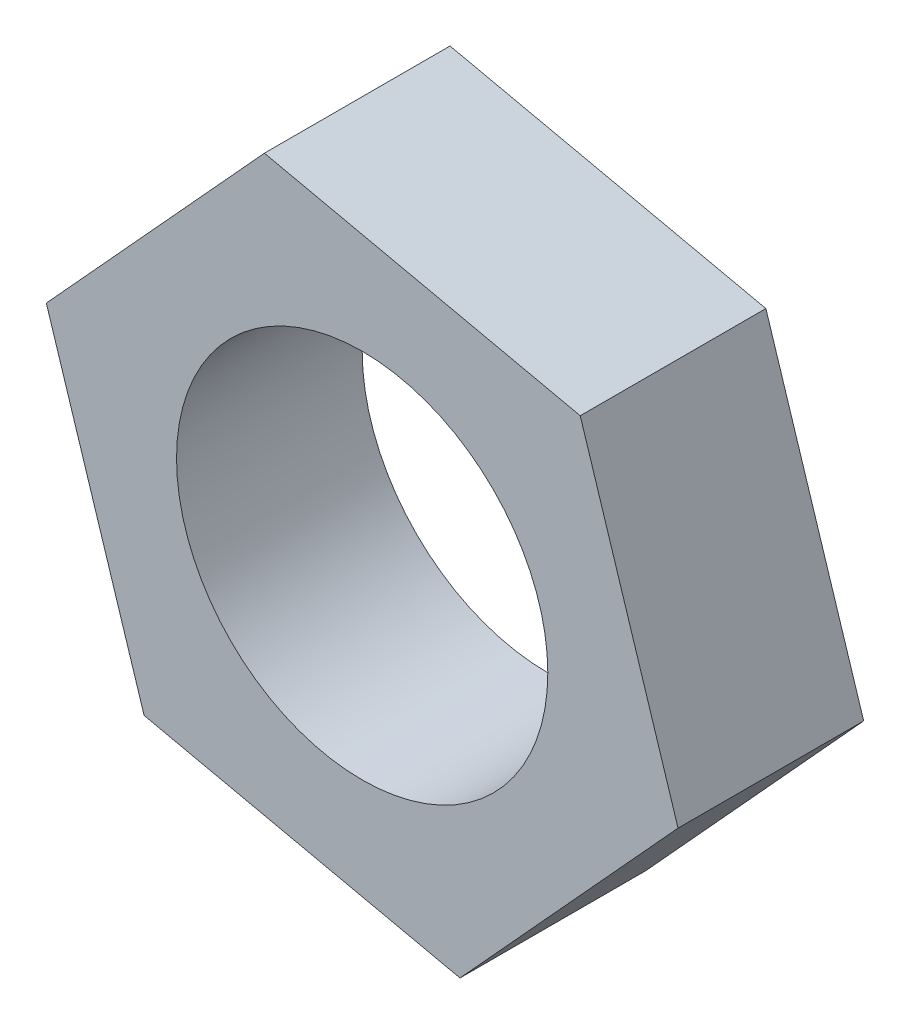
from build123d import *

# Parameters (mm, degrees)
SKETCH1_R           = 1
BOSS_EXTRUDE1_DEPTH = 1


with BuildPart() as part:
    # Sketch1 → Boss-Extrude1 (new body)
    with BuildSketch(Plane.XY):
        Polygon((-0.526790468, 1.66053517), (-1.701460874, 0.374053657), (-1.174670407, -1.286481512), (0.526790468, -1.66053517), (1.701460874, -0.374053657), (1.174670407, 1.286481512), align=None)
        Circle(SKETCH1_R, mode=Mode.SUBTRACT)
    extrude(amount=BOSS_EXTRUDE1_DEPTH)


solid = part.part
